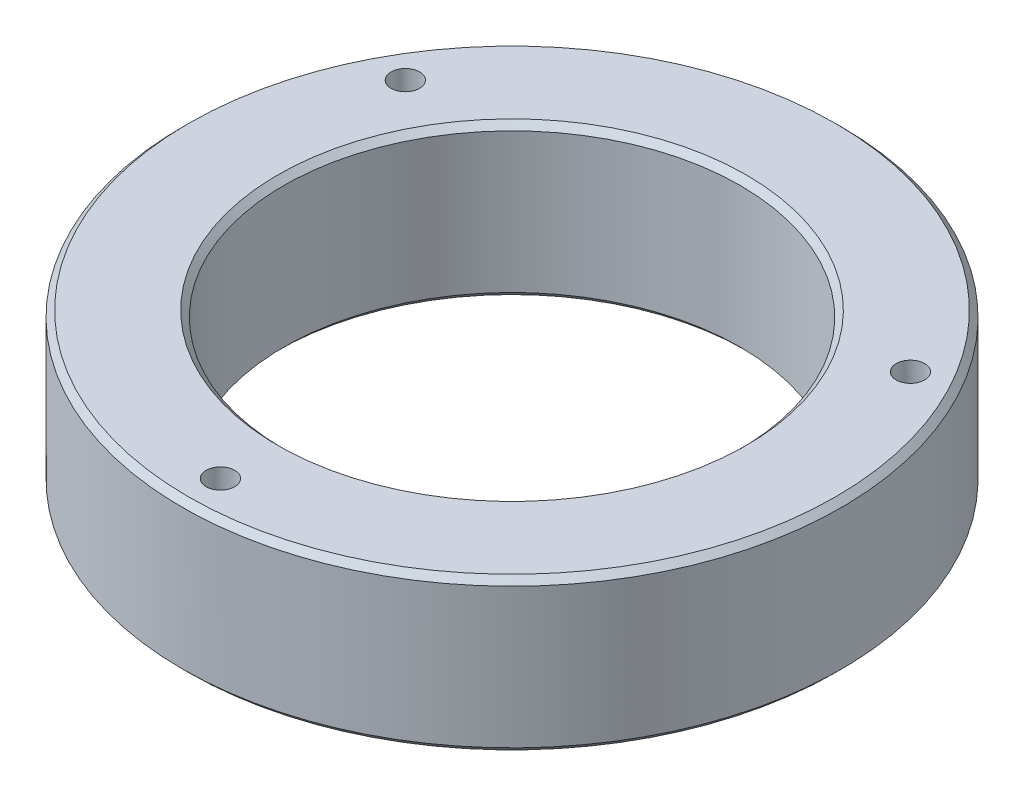
from build123d import *

# Parameters (mm, degrees)
SKETCH1_W          = 38.1
SKETCH1_H          = 25.3746
CHAMFER1_SIZE      = 1.524
CUT_EXTRUDE2_START = -19.05
SKETCH2_R          = 3.5687
CUT_EXTRUDE2_DEPTH = 76.2
CUT_EXTRUDE4_START = -19.05
SKETCH3_R          = 5.5626
CUT_EXTRUDE4_DEPTH = 9.652
CUT_EXTRUDE6_START = -19.05
SKETCH4_R          = 3.96875
CUT_EXTRUDE6_DEPTH = 25.4


with BuildPart() as part:
    # Sketch1 → Revolve1 (revolve)
    with BuildSketch(Plane(origin=(0, 0, 0), x_dir=(0, 1, 0), z_dir=(0, 0, 1)), mode=Mode.PRIVATE) as revolve1_sk:
        with Locations((0, 69.8373)):
            Rectangle(SKETCH1_W, SKETCH1_H)
    revolve(revolve1_sk.sketch.rotate(Axis((0, -44.45, 0), (0, 1, 0)), 270), axis=Axis((0, -44.45, 0), (0, 1, 0)))

    # Chamfer1
    chamfer1_edges = [part.edges().sort_by_distance(p)[0] for p in [
        (0, -19.05, 57.15),
        (0, 19.05, 57.15),
        (0, 19.05, 82.5246),
        (0, -19.05, 82.5246),
    ]]
    chamfer(chamfer1_edges, length=CHAMFER1_SIZE)

    # Sketch2 → Cut-Extrude2 (cut)
    with BuildSketch(Plane(origin=(0, 0, 0), x_dir=(-1, 0, 0), z_dir=(0, 1, 0)).offset(CUT_EXTRUDE2_START)):
        with Locations(Location((0, 73.025, 0), (0, 0, 270))):
            Circle(SKETCH2_R)
        with Locations(Location((-63.246, -36.5252, 0), (0, 0, 270))):
            Circle(SKETCH2_R)
        with Locations(Location((63.246, -36.5252, 0), (0, 0, 270))):
            Circle(SKETCH2_R)
    extrude(amount=CUT_EXTRUDE2_DEPTH, mode=Mode.SUBTRACT)

    # Sketch3 → Cut-Extrude4 (cut)
    with BuildSketch(Plane(origin=(0, 0, 0), x_dir=(-1, 0, 0), z_dir=(0, 1, 0)).offset(CUT_EXTRUDE4_START)):
        with Locations(Location((0, 73.025, 0), (0, 0, 90))):
            Circle(SKETCH3_R)
        with Locations(Location((-63.246, -36.5252, 0), (0, 0, 90))):
            Circle(SKETCH3_R)
        with Locations(Location((63.246, -36.5252, 0), (0, 0, 90))):
            Circle(SKETCH3_R)
    extrude(amount=CUT_EXTRUDE4_DEPTH, mode=Mode.SUBTRACT)

    # Sketch4 → Cut-Extrude6 (cut)
    with BuildSketch(Plane(origin=(0, 0, 0), x_dir=(-1, 0, 0), z_dir=(0, 1, 0)).offset(CUT_EXTRUDE6_START)):
        with Locations(Location((-69.85, 0, 0), (0, 0, 90))):
            Circle(SKETCH4_R)
        with Locations(Location((69.85, 0, 0), (0, 0, 90))):
            Circle(SKETCH4_R)
    extrude(amount=CUT_EXTRUDE6_DEPTH, mode=Mode.SUBTRACT)


solid = part.part
